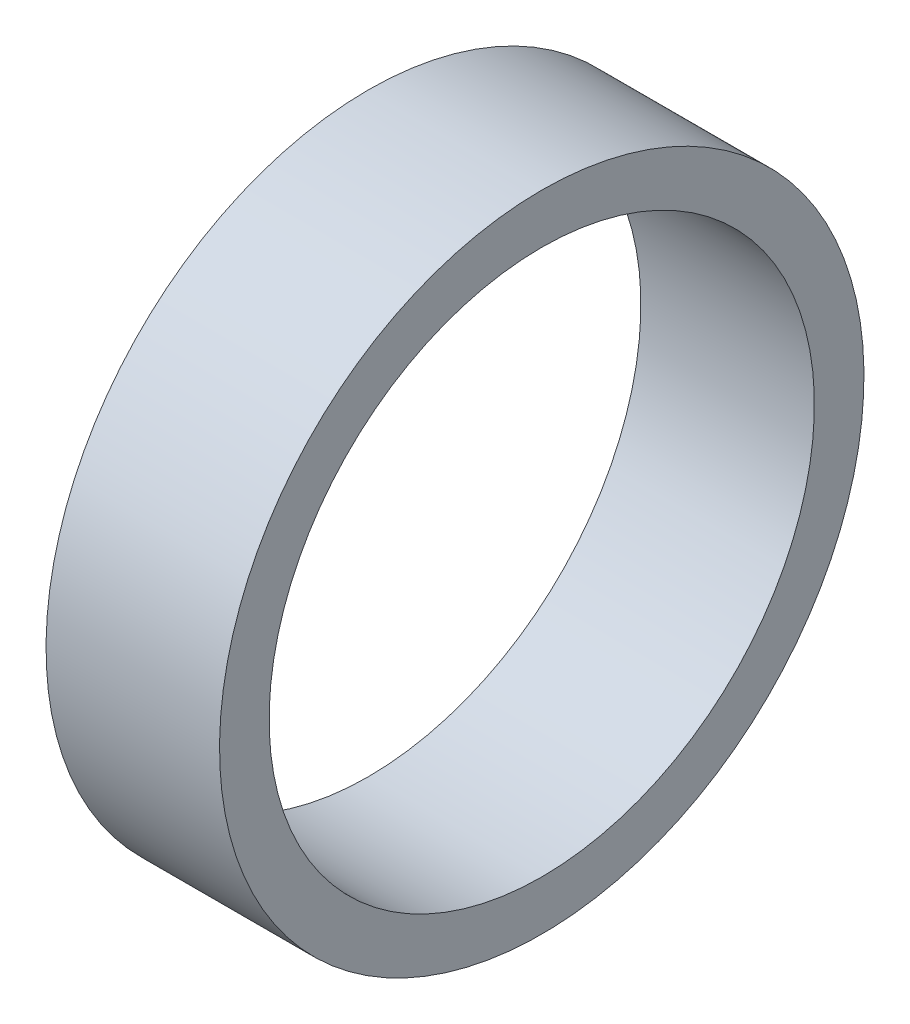
from build123d import *

# Parameters (mm, degrees)
SKETCH2_W = 7
SKETCH2_H = 2


with BuildPart() as part:
    # Sketch2 → Revolve1 (revolve)
    with BuildSketch(Plane.XY):
        with Locations((-3.5, 12)):
            Rectangle(SKETCH2_W, SKETCH2_H)
    revolve(axis=Axis((0, 0, 0), (-1, 0, 0)))


solid = part.part
